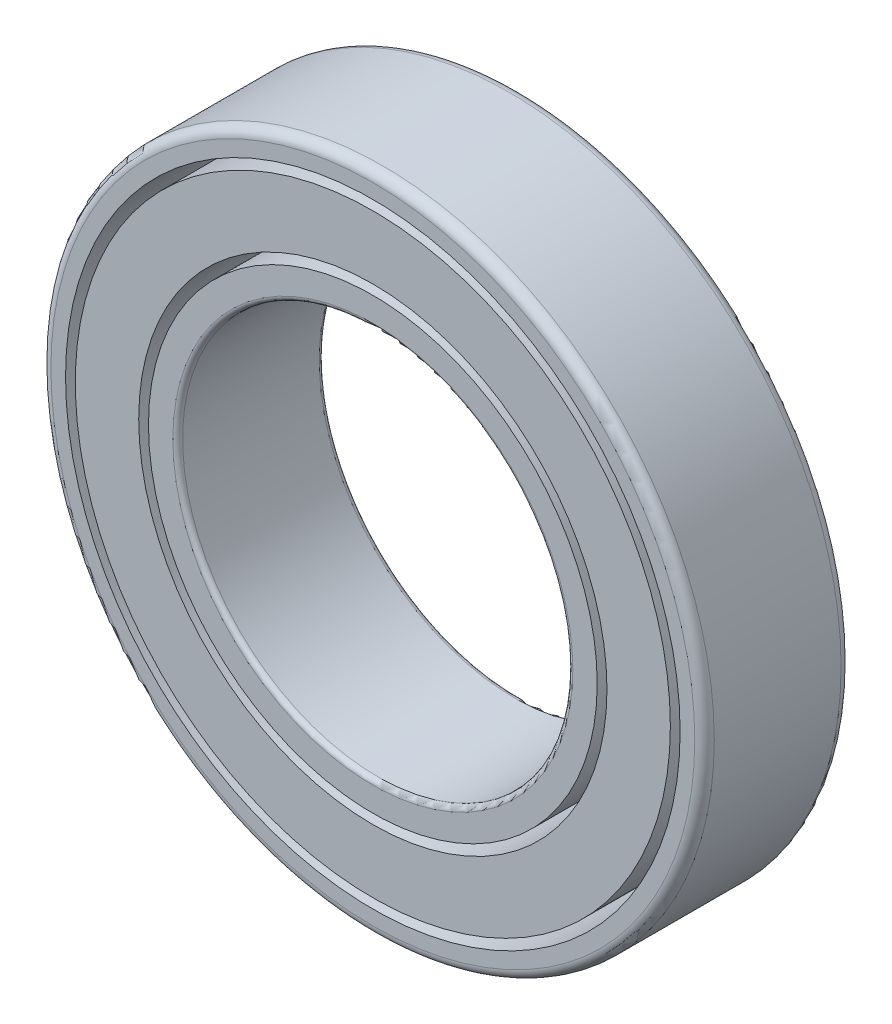
from build123d import *

# Parameters (mm, degrees)
CROQUIS1_R                = 23
CROQUIS1_R_2              = 20
SALIENTE_EXTRUIR1_DEPTH   = 7.5
CROQUIS1_R_3              = 30.5
CROQUIS1_R_4              = 24
SALIENTE_EXTRUIR1_2_DEPTH = 7.5
CROQUIS1_R_5              = 34
CROQUIS1_R_6              = 31.5
SALIENTE_EXTRUIR1_3_DEPTH = 7.5
REDONDEO1_R               = 1
REDONDEO2_R               = 0.5


with BuildPart() as part:
    # Croquis1 → Saliente-Extruir1 (new, symmetric)
    with BuildSketch(Plane.XY):
        Circle(CROQUIS1_R)
        Circle(CROQUIS1_R_2, mode=Mode.SUBTRACT)
    extrude(amount=SALIENTE_EXTRUIR1_DEPTH, both=True)

    # Redondeo2
    redondeo2_edges = [part.edges().sort_by_distance(p)[0] for p in [
        (-20, 0, -7.5),
        (-20, 0, 7.5),
    ]]
    fillet(redondeo2_edges, radius=REDONDEO2_R)


with BuildPart() as body_2:
    # Croquis1 → Saliente-Extruir1 2 (new, symmetric)
    with BuildSketch(Plane.XY):
        Circle(CROQUIS1_R_3)
        Circle(CROQUIS1_R_4, mode=Mode.SUBTRACT)
    extrude(amount=SALIENTE_EXTRUIR1_2_DEPTH, both=True)


with BuildPart() as body_3:
    # Croquis1 → Saliente-Extruir1 3 (new, symmetric)
    with BuildSketch(Plane.XY):
        Circle(CROQUIS1_R_5)
        Circle(CROQUIS1_R_6, mode=Mode.SUBTRACT)
    extrude(amount=SALIENTE_EXTRUIR1_3_DEPTH, both=True)

    # Redondeo1
    redondeo1_edges = [body_3.edges().sort_by_distance(p)[0] for p in [
        (-34, 0, -7.5),
        (-34, 0, 7.5),
    ]]
    fillet(redondeo1_edges, radius=REDONDEO1_R)


solid = Compound([part.part, body_2.part, body_3.part])
